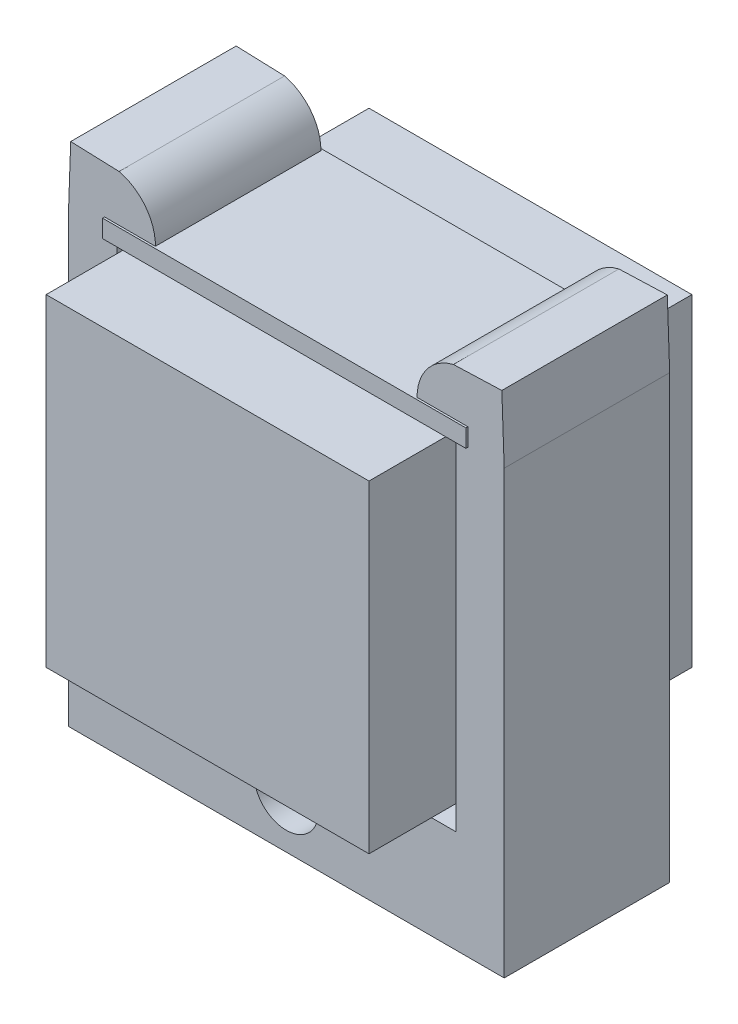
from build123d import *

# Parameters (mm, degrees)
SKETCH1_W                            = 45
SKETCH1_H                            = 21
BOSS_EXTRUDE1_DEPTH                  = 2.2
SKETCH2_W                            = 40
SKETCH2_H                            = 40
BOSS_EXTRUDE2_DEPTH                  = 40
SKETCH3_W                            = 42
SKETCH3_H                            = 12.7
SKETCH3_R                            = 4
SNAPFIT_42MM_SPACING_6MM_WIDTH_DEPTH = 10.25


with BuildPart() as part:
    # Sketch1 → Boss-Extrude1 (new body)
    with BuildSketch(Plane(origin=(0, 0, 0), x_dir=(1, 0, 0), z_dir=(0, 1, 0))):
        Rectangle(SKETCH1_W, SKETCH1_H)
    extrude(amount=BOSS_EXTRUDE1_DEPTH)


with BuildPart() as body_2:
    # Sketch2 → Boss-Extrude2 (new body)
    with BuildSketch(Plane(origin=(0, 0, 0), x_dir=(1, 0, 0), z_dir=(0, 1, 0))):
        Rectangle(SKETCH2_W, SKETCH2_H)
    extrude(amount=-BOSS_EXTRUDE2_DEPTH)


with BuildPart() as body_3:
    # Sketch3 → SnapFit-42mm_spacing-6mm_width (new, symmetric)
    # profile 1 of 3: a face of its own
    with BuildSketch(Plane.XY):
        with Locations((0, -48.35)):
            Rectangle(SKETCH3_W, SKETCH3_H)
        with Locations((0, -48.35)):
            Circle(SKETCH3_R, mode=Mode.SUBTRACT)
    # profile 2 of 3: a face of its own
    with BuildSketch(Plane.XY):
        with BuildLine():
            Line((-27, -54.7), (-21, -54.7))
            Line((-21, -54.7), (-21, -42))
            Line((-21, -42), (-21, 0))
            Line((-21, 0), (-20.921478633, 2.19859828))
            Line((-20.921478633, 2.19859828), (-16.211152324, 2.03037234))
            ThreePointArc((-16.211152324, 2.03037234), (-17.403379448, 5.80546144), (-20.711152324, 7.980626223))
            Line((-20.711152324, 7.980626223), (-26.70732945, 8.194775406))
            Line((-26.70732945, 8.194775406), (-27, 0))
            Line((-27, 0), (-27, -54.7))
        make_face()
    # profile 3 of 3: a face of its own
    with BuildSketch(Plane.XY):
        with BuildLine():
            Line((21, -42), (21, -54.7))
            Line((21, -54.7), (27, -54.7))
            Line((27, -54.7), (27, 0))
            Line((27, 0), (26.70732945, 8.194775406))
            Line((26.70732945, 8.194775406), (20.711152324, 7.980626223))
            ThreePointArc((20.711152324, 7.980626223), (17.403379448, 5.80546144), (16.211152324, 2.03037234))
            Line((16.211152324, 2.03037234), (20.921478633, 2.19859828))
            Line((20.921478633, 2.19859828), (21, 0))
            Line((21, 0), (21, -42))
        make_face()
    extrude(amount=SNAPFIT_42MM_SPACING_6MM_WIDTH_DEPTH, both=True)


solid = Compound([part.part, body_2.part, body_3.part])
